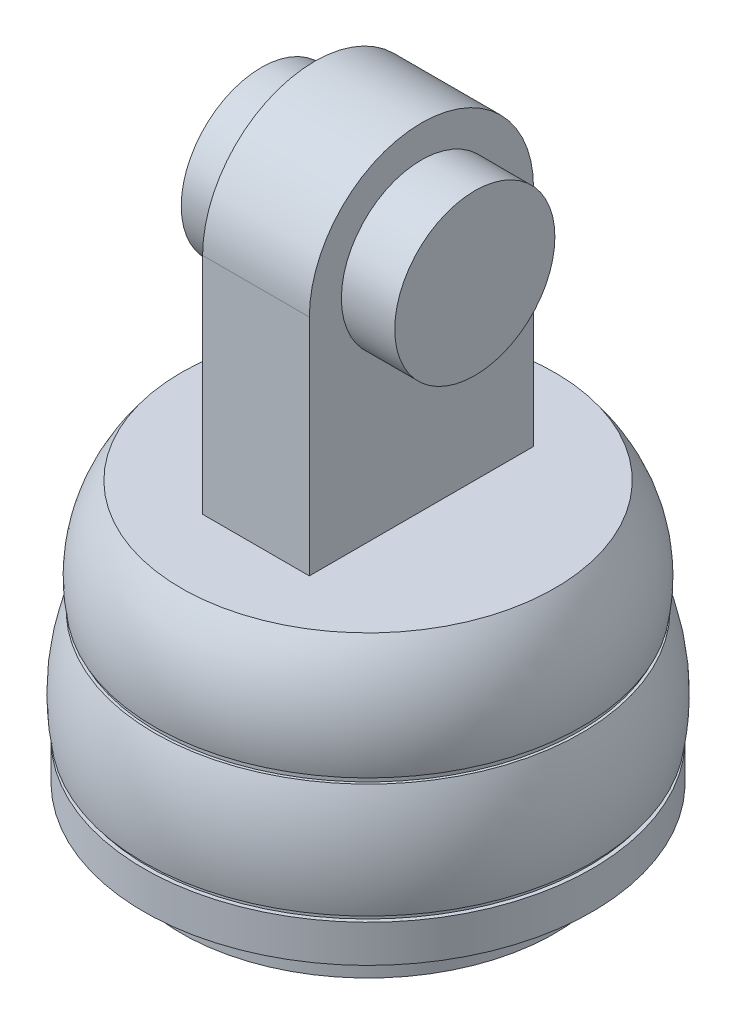
from build123d import *

# Parameters (mm, degrees)
SKETCH2_R            = 39.5
BOSS_EXTRUDE1_DEPTH  = 1
SKETCH4_R            = 41.25
BOSS_EXTRUDE2_DEPTH  = 1
SKETCH5_R            = 42
BOSS_EXTRUDE3_DEPTH  = 7
SKETCH6_R            = 35
BOSS_EXTRUDE4_DEPTH  = 7
BOSS_EXTRUDE5_DEPTH  = 1
CIRPATTERN1_COUNT    = 10
SKETCH9_R            = 15
BOSS_EXTRUDE6_DEPTH  = 10
SKETCH10_W           = 20
SKETCH10_H           = 42
BOSS_EXTRUDE7_DEPTH  = 42
BOSS_EXTRUDE8_START  = -20
BOSS_EXTRUDE8_DEPTH  = 20
SKETCH12_R           = 15
BOSS_EXTRUDE9_DEPTH  = 10
BOSS_EXTRUDE10_START = 10
SKETCH13_R           = 15
BOSS_EXTRUDE10_DEPTH = 10


with BuildPart() as part:
    # Sketch1 → Revolve1 (revolve)
    with BuildSketch(Plane.XY):
        with BuildLine():
            Line((-35, 0), (0, 0))
            Line((0, 0), (0, -20))
            Line((0, -20), (-40, -20))
            ThreePointArc((-40, -20), (-39.657515479, -9.46062113), (-35, 0))
        make_face()
    revolve(axis=Axis((0, 0, 0), (0, -1, 0)))

    # Sketch2 → Boss-Extrude1 (add)
    with BuildSketch(Plane.XZ.offset(20)):
        Circle(SKETCH2_R)
    extrude(amount=BOSS_EXTRUDE1_DEPTH)

    # Sketch3 → Revolve2 (revolve)
    with BuildSketch(Plane(origin=(0, 0, 0), x_dir=(0, 0, -1), z_dir=(1, 0, 0)), mode=Mode.PRIVATE) as revolve2_sk:
        with BuildLine():
            Line((0, -21), (-40, -21))
            ThreePointArc((-40, -21), (-42.384109041, -30.861589096), (-42, -41))
            Line((-42, -41), (0, -41))
            Line((0, -41), (0, -21))
        make_face()
    revolve(revolve2_sk.sketch.rotate(Axis((0, -21, 0), (0, -1, 0)), 90), axis=Axis((0, -21, 0), (0, -1, 0)))

    # Sketch4 → Boss-Extrude2 (add)
    with BuildSketch(Plane.XZ.offset(41)):
        with Locations(Location((0, 0, 0), (0, 0, 270))):
            Circle(SKETCH4_R)
    extrude(amount=BOSS_EXTRUDE2_DEPTH)

    # Sketch5 → Boss-Extrude3 (add)
    with BuildSketch(Plane.XZ.offset(42)):
        with Locations(Location((0, 0, 0), (0, 0, 270))):
            Circle(SKETCH5_R)
    extrude(amount=BOSS_EXTRUDE3_DEPTH)

    # Sketch6 → Boss-Extrude4 (add)
    with BuildSketch(Plane.XZ.offset(49)):
        with Locations(Location((0, 0, 0), (0, 0, 270))):
            Circle(SKETCH6_R)
    extrude(amount=BOSS_EXTRUDE4_DEPTH)

    # Sketch7 → Boss-Extrude5 (add)
    with BuildSketch(Plane.XZ.offset(49)):
        Polygon((38.446071931, -2.233948034), (40.380727679, -1.116974017), (40.380727679, 1.116974017), (38.446071931, 2.233948034), (36.511416183, 1.116974017), (36.511416183, -1.116974017), align=None)
        Polygon((38.446071931, -1.546904417), (39.785730453, -0.773452208), (39.785730453, 0.773452208), (38.446071931, 1.546904417), (37.106413409, 0.773452208), (37.106413409, -0.773452208), align=None, mode=Mode.SUBTRACT)
    boss_extrude5 = extrude(amount=BOSS_EXTRUDE5_DEPTH)

    # CirPattern1: Boss-Extrude5 ×10 about axis
    cirpattern1_axis = Axis((0, 0, 0), (0, 1, 0))
    for i in range(1, CIRPATTERN1_COUNT):
        add(boss_extrude5.rotate(cirpattern1_axis, i * 360 / CIRPATTERN1_COUNT))

    # Sketch9 → Boss-Extrude6 (add)
    with BuildSketch(Plane.XZ.offset(56)):
        with Locations(Location((0, 0, 0), (0, 0, 270))):
            Circle(SKETCH9_R)
    extrude(amount=BOSS_EXTRUDE6_DEPTH)

    # Sketch10 → Boss-Extrude7 (add)
    with BuildSketch(Plane(origin=(0, 0, 0), x_dir=(1, 0, 0), z_dir=(0, 1, 0))):
        Rectangle(SKETCH10_W, SKETCH10_H)
    extrude(amount=BOSS_EXTRUDE7_DEPTH)

    # Sketch11 → Boss-Extrude8 (add)
    with BuildSketch(Plane(origin=(10, 0, 0), x_dir=(0, 0, -1), z_dir=(1, 0, 0)).offset(BOSS_EXTRUDE8_START)):
        with BuildLine():
            Line((-21, 42), (21, 42))
            ThreePointArc((21, 42), (0, 63), (-21, 42))
        make_face()
    extrude(amount=BOSS_EXTRUDE8_DEPTH)

    # Sketch12 → Boss-Extrude9 (add)
    with BuildSketch(Plane.ZY.offset(10)):
        with Locations(Location((0, 42, 0), (0, 0, 180))):
            Circle(SKETCH12_R)
    extrude(amount=BOSS_EXTRUDE9_DEPTH)

    # Sketch13 → Boss-Extrude10 (add)
    with BuildSketch(Plane(origin=(10, 0, 0), x_dir=(0, 0, -1), z_dir=(1, 0, 0)).offset(BOSS_EXTRUDE10_START)):
        with Locations((0, 42)):
            Circle(SKETCH13_R)
    extrude(amount=-BOSS_EXTRUDE10_DEPTH)


solid = part.part
